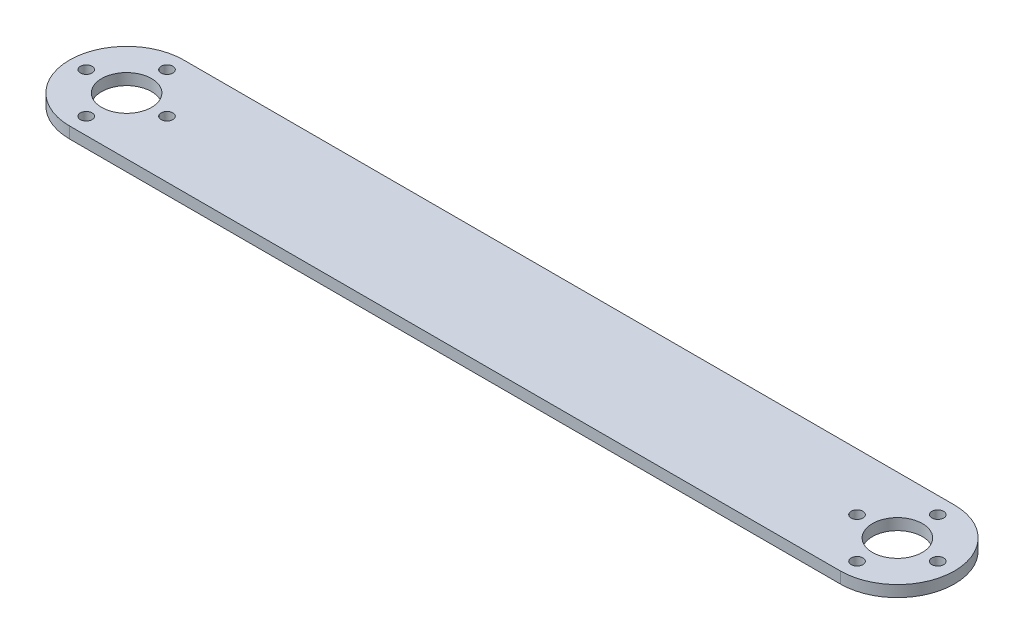
from build123d import *

# Parameters (mm, degrees)
SKETCH1_R           = 7
BOSS_EXTRUDE1_DEPTH = 3.175
SKETCH2_R           = 1.65
CUT_EXTRUDE1_DEPTH  = 10


with BuildPart() as part:
    # Sketch1 → Boss-Extrude1 (new body)
    with BuildSketch(Plane(origin=(0, 0, 0), x_dir=(1, 0, 0), z_dir=(0, 1, 0))):
        with BuildLine():
            Line((0, 0), (216, 0))
            ThreePointArc((216, 0), (232, 16), (216, 32))
            Line((216, 32), (0, 32))
            ThreePointArc((0, 32), (-16, 16), (0, 0))
        make_face()
        with Locations(Location((0, 16, 0), (0, 0, 270))):
            Circle(SKETCH1_R, mode=Mode.SUBTRACT)
        with Locations(Location((216, 16, 0), (0, 0, 270))):
            Circle(SKETCH1_R, mode=Mode.SUBTRACT)
    extrude(amount=BOSS_EXTRUDE1_DEPTH)

    # Sketch2 → Cut-Extrude1 (cut)
    with BuildSketch(Plane(origin=(0, 3.175, 0), x_dir=(1, 0, 0), z_dir=(0, 1, 0))):
        with Locations(Location((204.686291501, 16, 0), (0, 0, 270))):
            Circle(SKETCH2_R)
        with Locations(Location((216, 27.313708499, 0), (0, 0, 270))):
            Circle(SKETCH2_R)
        with Locations(Location((-11.313708499, 16, 0), (0, 0, 270))):
            Circle(SKETCH2_R)
        with Locations(Location((0, 27.313708499, 0), (0, 0, 270))):
            Circle(SKETCH2_R)
        with Locations(Location((11.313708499, 16, 0), (0, 0, 270))):
            Circle(SKETCH2_R)
        with Locations(Location((0, 4.686291501, 0), (0, 0, 270))):
            Circle(SKETCH2_R)
        with Locations(Location((216, 4.686291501, 0), (0, 0, 270))):
            Circle(SKETCH2_R)
        with Locations(Location((227.313708499, 16, 0), (0, 0, 270))):
            Circle(SKETCH2_R)
    extrude(amount=-CUT_EXTRUDE1_DEPTH, mode=Mode.SUBTRACT)


solid = part.part
